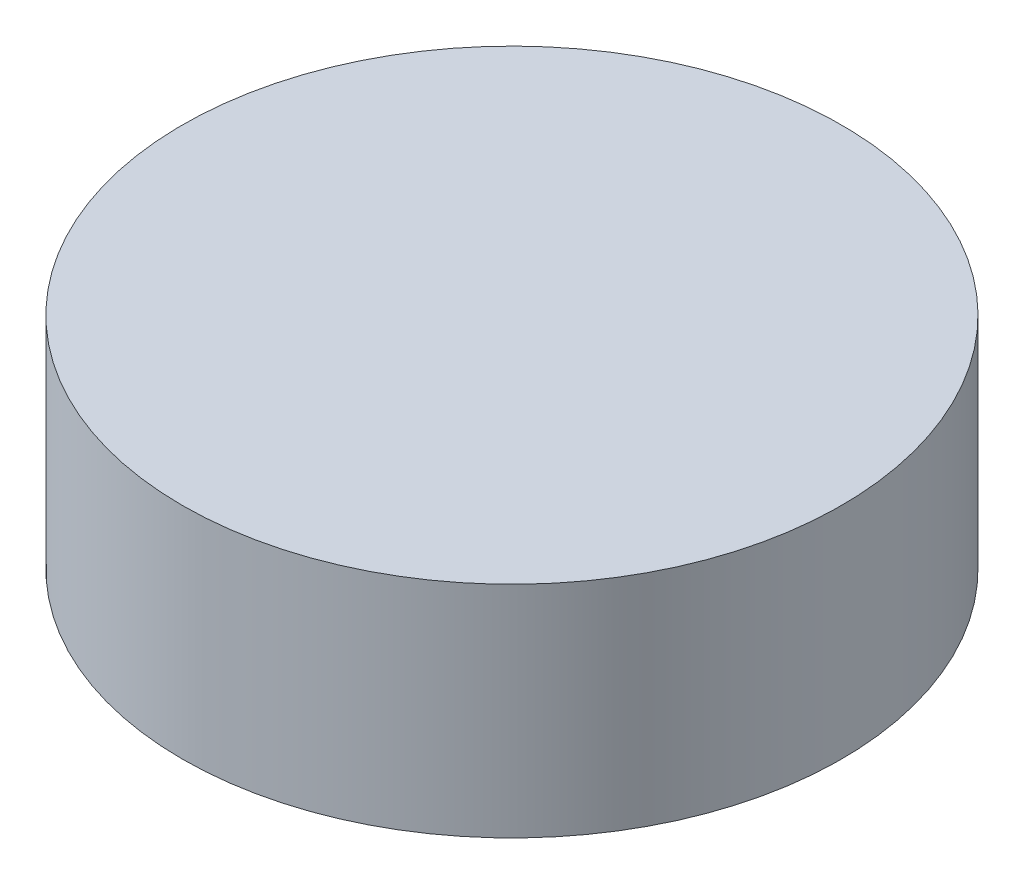
from build123d import *

# Parameters (mm, degrees)
SKETCH1_R           = 3
BOSS_EXTRUDE1_DEPTH = 2


with BuildPart() as part:
    # Sketch1 → Boss-Extrude1 (new body)
    with BuildSketch(Plane(origin=(0, 0, 0), x_dir=(1, 0, 0), z_dir=(0, 1, 0))):
        with Locations(Location((0, 0, 0), (0, 0, 270))):
            Circle(SKETCH1_R)
    extrude(amount=BOSS_EXTRUDE1_DEPTH)


solid = part.part
